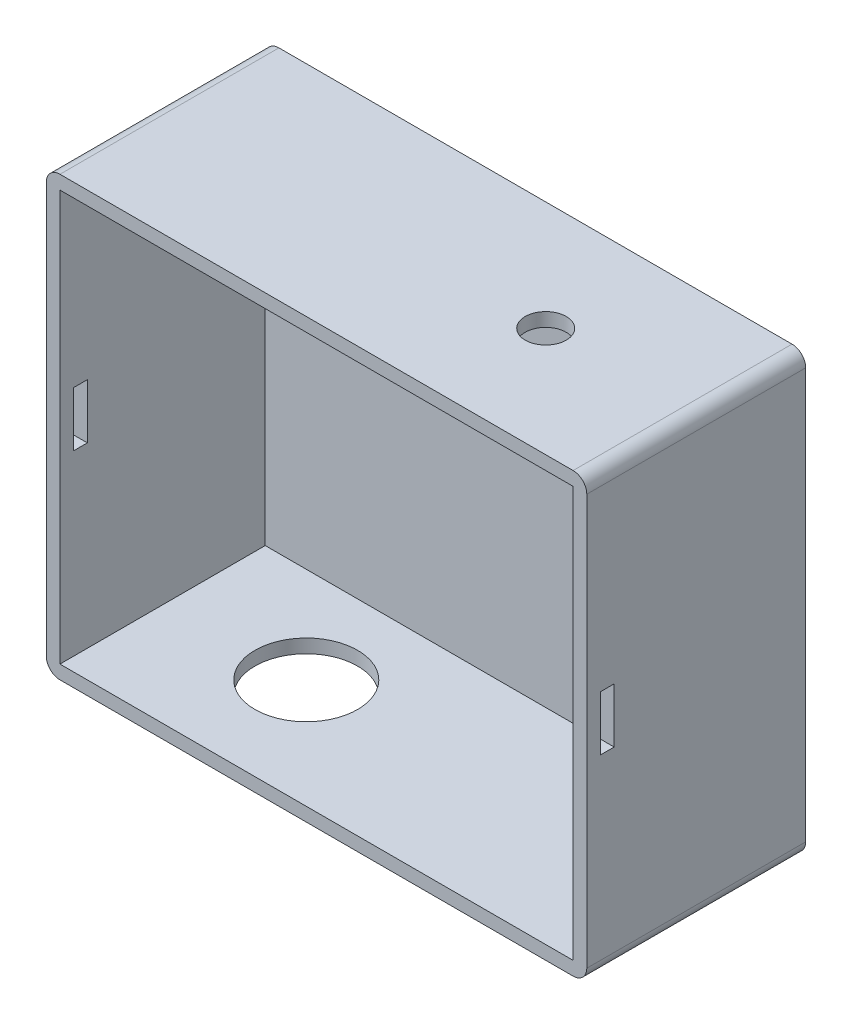
from build123d import *

# Parameters (mm, degrees)
SKETCH_218_W                = 79
SKETCH_218_H                = 64
SKETCH_218_W_2              = 75
SKETCH_218_H_2              = 60
EXTRUDE_371_DEPTH           = 30
SKETCH_3_W                  = 79
SKETCH_3_H                  = 64
SKETCH_3_W_2                = 75
SKETCH_3_H_2                = 60
EXTRUDE_416_DEPTH           = 2
CUT_EXTRUDE_START           = -32
SKETCH_3_2_R                = 7.5
CUT_EXTRUDE_880_DEPTH       = 2
CUT_EXTRUDE_START_2         = 32
SKETCH_3_3_R                = 3
CUT_EXTRUDE_941_DEPTH       = 2
CUT_EXTRUDE_1138_DEPTH      = 60.027535947
CUT_EXTRUDE_1138_DEPTH_BACK = 60.027535947
SKETCH_4_W                  = 2
SKETCH_4_H                  = 8
FILLET_1191_R               = 2


with BuildPart() as part:
    # Sketch 218 → Extrude 371 (new body)
    with BuildSketch(Plane.XY):
        Rectangle(SKETCH_218_W, SKETCH_218_H)
        Rectangle(SKETCH_218_W_2, SKETCH_218_H_2, mode=Mode.SUBTRACT)
    extrude(amount=EXTRUDE_371_DEPTH)

    # Sketch 3 → Extrude 416 (add)
    # profile 1 of 2: a face of its own
    with BuildSketch(Plane.XY):
        Rectangle(SKETCH_3_W, SKETCH_3_H)
        Rectangle(SKETCH_3_W_2, SKETCH_3_H_2, mode=Mode.SUBTRACT)
    # profile 2 of 2: a face of its own
    with BuildSketch(Plane.XY):
        Rectangle(SKETCH_3_W_2, SKETCH_3_H_2)
    extrude(amount=-EXTRUDE_416_DEPTH)

    # Sketch 3 2 → Cut-Extrude 880 (cut)
    with BuildSketch(Plane(origin=(0, 0, 0), x_dir=(1, 0, 0), z_dir=(0, 1, 0)).offset(CUT_EXTRUDE_START)):
        with Locations(Location((-17.5, -14, 0), (0, 0, 270))):
            Circle(SKETCH_3_2_R)
    extrude(amount=CUT_EXTRUDE_880_DEPTH, mode=Mode.SUBTRACT)

    # 草图3<3> → Cut-Extrude 941 (cut)
    with BuildSketch(Plane(origin=(0, 0, 0), x_dir=(1, 0, 0), z_dir=(0, 1, 0)).offset(CUT_EXTRUDE_START_2)):
        with Locations(Location((17.5, -14, 0), (0, 0, 90))):
            Circle(SKETCH_3_3_R)
    extrude(amount=-CUT_EXTRUDE_941_DEPTH, mode=Mode.SUBTRACT)

    # 草图4 → Cut-Extrude 1138 (cut, two sides: drawn at the far end of the back side and taken through both)
    with BuildSketch(Plane(origin=(0, 0, 0), x_dir=(0, 0, -1), z_dir=(1, 0, 0)).offset(-CUT_EXTRUDE_1138_DEPTH_BACK)):
        with Locations((-27, 0)):
            Rectangle(SKETCH_4_W, SKETCH_4_H)
    extrude(amount=CUT_EXTRUDE_1138_DEPTH + CUT_EXTRUDE_1138_DEPTH_BACK, mode=Mode.SUBTRACT)

    # Fillet 1191
    fillet_1191_edges = [part.edges().sort_by_distance(p)[0] for p in [
        (-39.5, -32, 14),
        (-39.5, 32, 14),
        (39.5, 32, 14),
        (39.5, -32, 14),
    ]]
    fillet(fillet_1191_edges, radius=FILLET_1191_R)


solid = part.part
